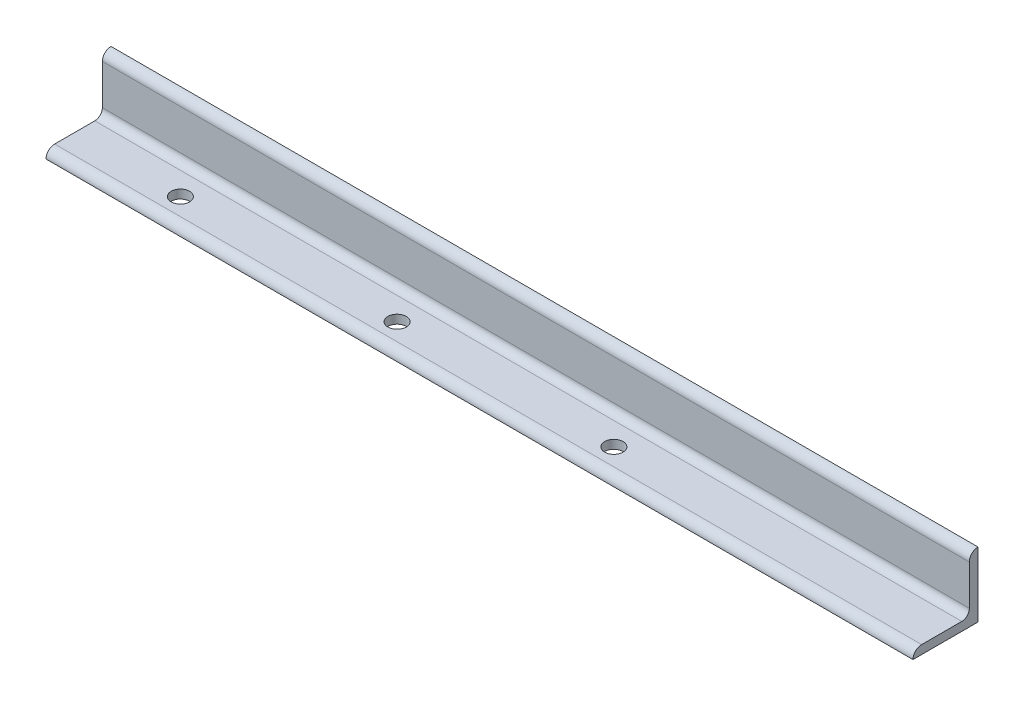
from build123d import *

# Parameters (mm, degrees)
ANGLE_IRON_25_X_25_X_4_1_DEPTH = 400
SKETCH12_R                     = 4.25
CUT_EXTRUDE1_DEPTH             = 10


with BuildPart() as part:
    # Sketch11 → Angle iron 25 X 25 X 4(1) (new body)
    with BuildSketch(Plane.YZ):
        with BuildLine():
            Line((0, 0), (0, 30))
            ThreePointArc((0, 30), (2.828427125, 28.828427125), (4, 26))
            Line((4, 26), (4, 7.5))
            ThreePointArc((4, 7.5), (5.025126266, 5.025126266), (7.5, 4))
            Line((7.5, 4), (26, 4))
            ThreePointArc((26, 4), (28.828427125, 2.828427125), (30, 0))
            Line((30, 0), (0, 0))
        make_face()
    extrude(amount=ANGLE_IRON_25_X_25_X_4_1_DEPTH)

    # Sketch12 → Cut-Extrude1 (cut)
    with BuildSketch(Plane(origin=(0, 4, 0), x_dir=(1, 0, 0), z_dir=(0, 1, 0))):
        with Locations(Location((50, -18, 0), (0, 0, 270))):
            Circle(SKETCH12_R)
        with Locations(Location((150, -18, 0), (0, 0, 270))):
            Circle(SKETCH12_R)
        with Locations(Location((250, -18, 0), (0, 0, 270))):
            Circle(SKETCH12_R)
    extrude(amount=-CUT_EXTRUDE1_DEPTH, mode=Mode.SUBTRACT)


solid = part.part
